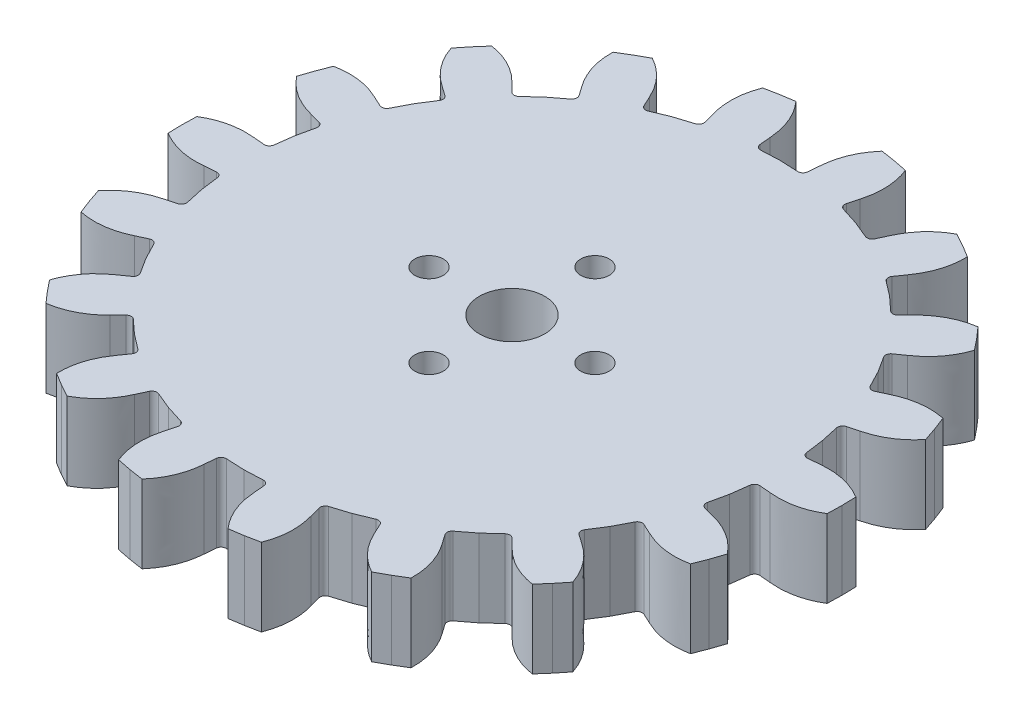
from build123d import *

# Parameters (mm, degrees)
BOSS_EXTRUDE1_DEPTH      = 7.5
FILLET1_R                = 0.5
CIRPATTERN1_COUNT        = 18
FILLET1_OF_CIRPATTERN1_R = 0.5
SKETCH3_R                = 3.15
SKETCH3_R_2              = 1.375
CUT_EXTRUDE1_DEPTH       = 46.403760092


with BuildPart() as part:
    # Sketch2 → Boss-Extrude1 (new body)
    with BuildSketch(Plane(origin=(0, 0, 0), x_dir=(1, 0, 0), z_dir=(0, 1, 0))):
        with BuildLine():
            Line((-25.739180512, 2.251886503), (-27.285772781, 2.387195794))
            add(Edge.make_bspline(
                [(-27.285772781, 2.387195794), (-29.733321363, 2.631764933), (-31.769733446, 1.387096518)],
                knots=[0, 0, 0, 1, 1, 1], degree=2))
            Line((-31.769733446, 1.387096518), (-31.8, 0))
            Line((-31.8, 0), (-31.769733446, -1.387096518))
            add(Edge.make_bspline(
                [(-27.285772781, -2.387195794), (-29.733321363, -2.631764933), (-31.769733446, -1.387096518)],
                knots=[0, 0, 0, 1, 1, 1], degree=2))
            Line((-27.285772781, -2.387195794), (-25.739180512, -2.251886503))
            Line((-25.739180512, -2.251886503), (-25.444970318, -4.48663479))
            Line((-25.444970318, -4.48663479), (0, 0))
            Line((0, 0), (-25.444970318, 4.48663479))
            Line((-25.444970318, 4.48663479), (-25.739180512, 2.251886503))
        make_face()
    boss_extrude1 = extrude(amount=BOSS_EXTRUDE1_DEPTH)

    # Fillet1
    fillet1_edges = [part.edges().sort_by_distance(p)[0] for p in [
        (-25.739180512, 3.75, 2.251886503),
        (-25.739180512, 3.75, -2.251886503),
    ]]
    fillet(fillet1_edges, radius=FILLET1_R)

    # CirPattern1: Boss-Extrude1 ×18 about axis
    cirpattern1_axis = Axis((0, 7.5, 0), (0, -1, 0))
    for i in range(1, CIRPATTERN1_COUNT):
        add(boss_extrude1.rotate(cirpattern1_axis, i * 360 / CIRPATTERN1_COUNT))

    # Fillet1 of CirPattern1
    fillet1_of_cirpattern1_edges = [part.edges().sort_by_distance(p)[0] for p in [
        (-24.957108537, 3.75, -6.687237078),
        (-23.416727448, 3.75, -10.919399338),
        (-21.164840944, 3.75, -14.819781174),
        (-18.269871459, 3.75, -18.269871459),
        (-14.819781174, 3.75, -21.164840944),
        (-10.919399338, 3.75, -23.416727448),
        (-6.687237078, 3.75, -24.957108537),
        (-2.251886503, 3.75, -25.739180512),
        (2.251886503, 3.75, -25.739180512),
        (6.687237078, 3.75, -24.957108537),
        (10.919399338, 3.75, -23.416727448),
        (14.819781174, 3.75, -21.164840944),
        (18.269871459, 3.75, -18.269871459),
        (21.164840944, 3.75, -14.819781174),
        (23.416727448, 3.75, -10.919399338),
        (24.957108537, 3.75, -6.687237078),
        (25.739180512, 3.75, -2.251886503),
        (25.739180512, 3.75, 2.251886503),
        (24.957108537, 3.75, 6.687237078),
        (23.416727448, 3.75, 10.919399338),
        (21.164840944, 3.75, 14.819781174),
        (18.269871459, 3.75, 18.269871459),
        (14.819781174, 3.75, 21.164840944),
        (10.919399338, 3.75, 23.416727448),
        (6.687237078, 3.75, 24.957108537),
        (2.251886503, 3.75, 25.739180512),
        (-2.251886503, 3.75, 25.739180512),
        (-6.687237078, 3.75, 24.957108537),
        (-10.919399338, 3.75, 23.416727448),
        (-14.819781174, 3.75, 21.164840944),
        (-18.269871459, 3.75, 18.269871459),
        (-21.164840944, 3.75, 14.819781174),
        (-23.416727448, 3.75, 10.919399338),
        (-24.957108537, 3.75, 6.687237078),
    ]]
    fillet(fillet1_of_cirpattern1_edges, radius=FILLET1_OF_CIRPATTERN1_R)

    # Sketch3 → Cut-Extrude1 (cut, through all)
    with BuildSketch(Plane(origin=(0, 7.5, 0), x_dir=(1, 0, 0), z_dir=(0, 1, 0))):
        with Locations(Location((0, 0, 0), (0, 0, 270))):
            Circle(SKETCH3_R)
        with Locations(Location((-8, 0, 0), (0, 0, 270))):
            Circle(SKETCH3_R_2)
        with Locations(Location((0, 8, 0), (0, 0, 270))):
            Circle(SKETCH3_R_2)
        with Locations(Location((8, 0, 0), (0, 0, 270))):
            Circle(SKETCH3_R_2)
        with Locations(Location((0, -8, 0), (0, 0, 270))):
            Circle(SKETCH3_R_2)
    extrude(amount=-CUT_EXTRUDE1_DEPTH, mode=Mode.SUBTRACT)


solid = part.part
